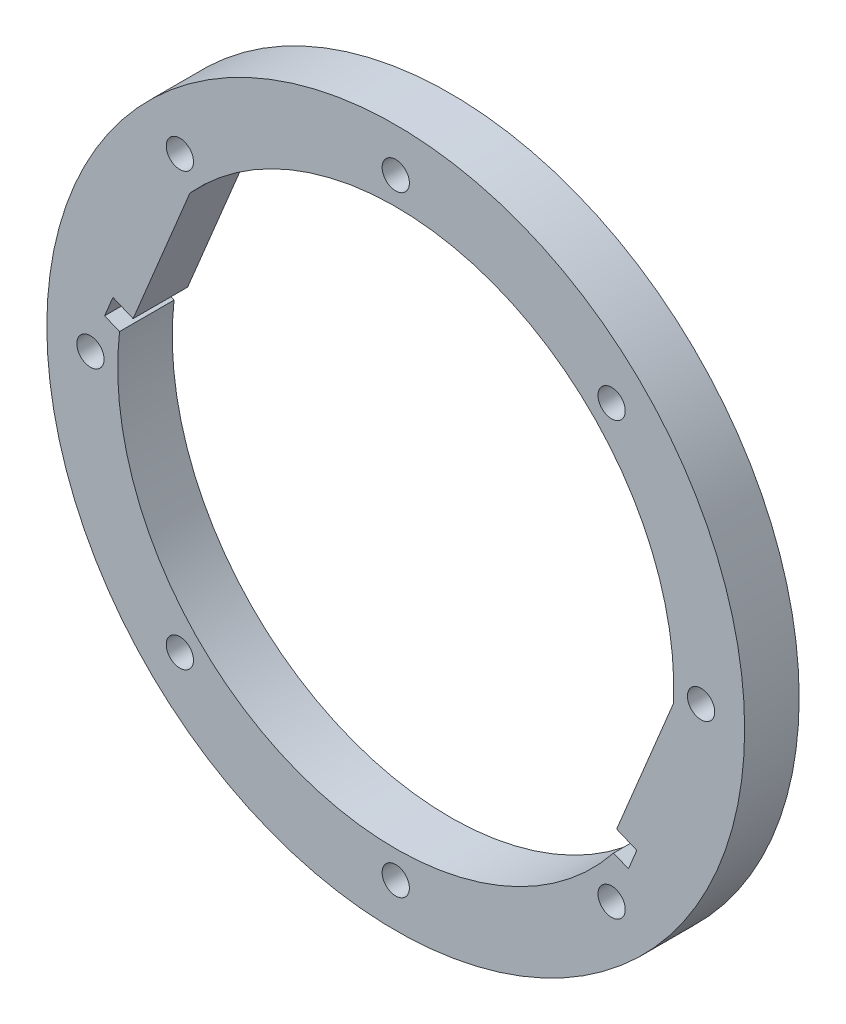
from build123d import *

# Parameters (mm, degrees)
CROQUIS1_R              = 32
SALIENTE_EXTRUIR1_DEPTH = 5
CROQUIS2_R              = 1.25
CORTAR_EXTRUIR1_DEPTH   = 46.530209751
CORTAR_EXTRUIR2_DEPTH   = 10


with BuildPart() as part:
    # Croquis1 → Saliente-Extruir1 (new body)
    with BuildSketch(Plane.XY):
        Circle(CROQUIS1_R)
    extrude(amount=SALIENTE_EXTRUIR1_DEPTH)

    # Croquis2 → Cortar-Extruir1 (cut, through all)
    with BuildSketch(Plane.XY.offset(5)):
        with Locations((0, 28)):
            Circle(CROQUIS2_R)
        with Locations((19.798989873, 19.798989873)):
            Circle(CROQUIS2_R)
        with Locations((28, 0)):
            Circle(CROQUIS2_R)
        with Locations((19.798989873, -19.798989873)):
            Circle(CROQUIS2_R)
        with Locations((0, -28)):
            Circle(CROQUIS2_R)
        with Locations((-19.798989873, -19.798989873)):
            Circle(CROQUIS2_R)
        with Locations((-28, 0)):
            Circle(CROQUIS2_R)
        with Locations((-19.798989873, 19.798989873)):
            Circle(CROQUIS2_R)
    extrude(amount=-CORTAR_EXTRUIR1_DEPTH, mode=Mode.SUBTRACT)

    # Croquis3 → Cortar-Extruir2 (cut)
    with BuildSketch(Plane.XY.offset(5)):
        with BuildLine():
            Line((-18.875585354, 17.145328155), (-24.086525942, 4.565004714))
            Line((-24.086525942, 4.565004714), (-25.934285007, 5.330371579))
            Line((-25.934285007, 5.330371579), (-26.699651872, 3.482612514))
            Line((-26.699651872, 3.482612514), (-25.332679411, 2.916393981))
            ThreePointArc((-25.332679411, 2.916393981), (-9.758427525, -23.558928079), (19.975111358, -15.850707436))
            Line((19.975111358, -15.850707436), (21.342083819, -16.416925969))
            Line((21.342083819, -16.416925969), (22.107450683, -14.569166904))
            Line((22.107450683, -14.569166904), (20.259691618, -13.803800039))
            Line((20.259691618, -13.803800039), (25.470632207, -1.223476598))
            ThreePointArc((25.470632207, -1.223476598), (9.758427525, 23.558928079), (-18.875585354, 17.145328155))
        make_face()
    extrude(amount=-CORTAR_EXTRUIR2_DEPTH, mode=Mode.SUBTRACT)


solid = part.part
